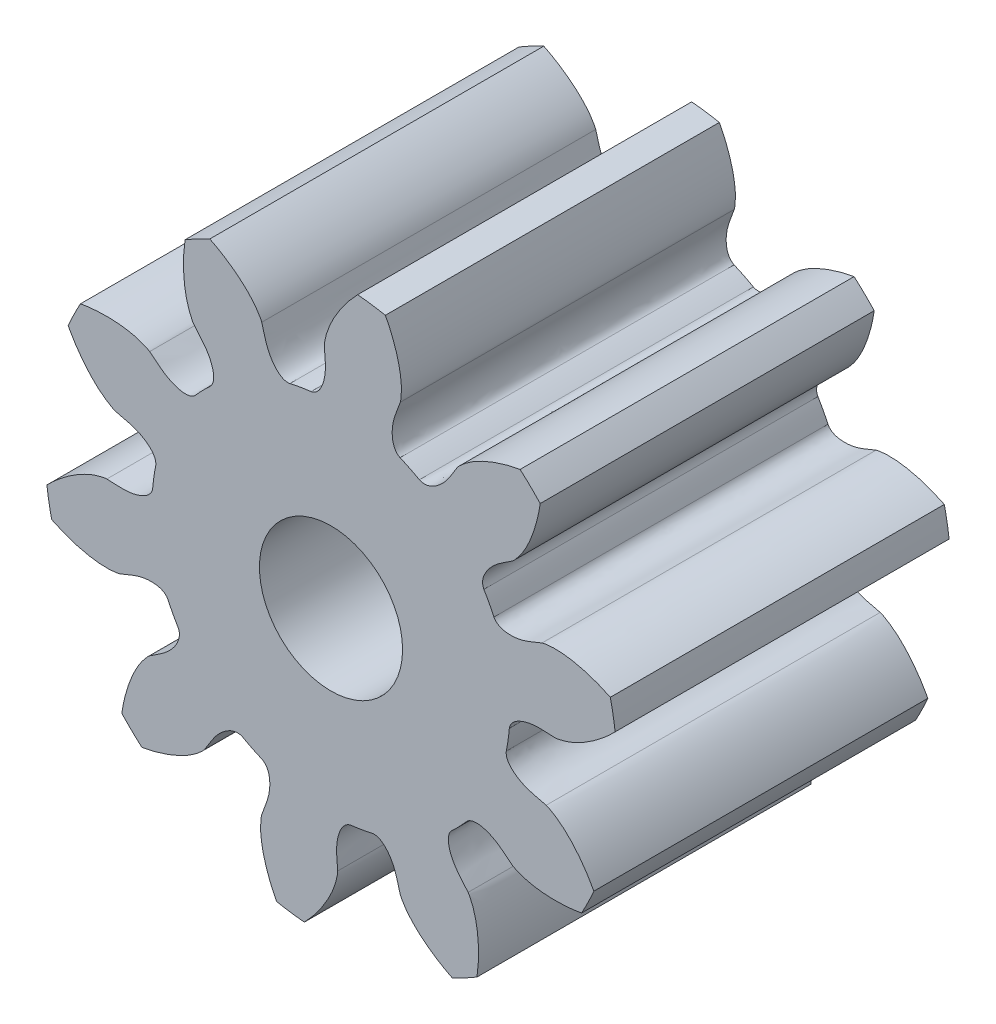
from build123d import *

# Parameters (mm, degrees)
ESQUISSE1_R        = 0.75
BOSS_EXTRU_1_DEPTH = 3.5


with BuildPart() as part:
    # Esquisse1 → Boss.-Extru.1 (new body)
    with BuildSketch(Plane.XY):
        with BuildLine():
            ThreePointArc((2.977310095, 0.368272455), (2.955741127, 0.513414445), (2.927100903, 0.657328154))
            add(Edge.make_bspline(
                [(2.211403727, 0.79214554), (2.222779445, 0.796220429), (2.274133198, 0.805614359), (2.359373738, 0.810478726), (2.538607422, 0.796225963), (2.732062921, 0.744216047), (2.878239296, 0.681280138), (2.927100903, 0.657328154)],
                knots=[0, 0, 0, 0, 0.036250587, 0.155621312, 0.255291203, 0.575254513, 0.744084786, 0.744084786, 0.744084786, 0.744084786], degree=3))
            add(Edge.make_bspline(
                [(2.211403727, 0.79214554), (2.132130324, 0.763749064), (1.99001212, 0.681956821), (1.750090704, 0.694113528), (1.707279056, 0.775127876)],
                knots=[0, 0, 0, 0, 0.252617676, 0.527509393, 0.527509393, 0.527509393, 0.527509393], degree=3))
            ThreePointArc((1.707279056, 0.775127876), (1.657764419, 0.876037746), (1.602292085, 0.973799299))
            add(Edge.make_bspline(
                [(1.90038092, 1.380707558), (1.832256922, 1.331212576), (1.684611138, 1.259880414), (1.559480437, 1.054813647), (1.602292085, 0.973799299)],
                knots=[0, 0, 0, 0, 0.252617676, 0.527509393, 0.527509393, 0.527509393, 0.527509393], degree=3))
            add(Edge.make_bspline(
                [(1.90038092, 1.380707558), (1.9101567, 1.387810078), (1.946851003, 1.424944725), (1.998895263, 1.49262786), (2.088102134, 1.648736761), (2.154127637, 1.837868182), (2.184488772, 1.994094501), (2.192229346, 2.04795764)],
                knots=[0, 0, 0, 0, 0.036250587, 0.155621312, 0.255291203, 0.575254513, 0.744084786, 0.744084786, 0.744084786, 0.744084786], degree=3))
            ThreePointArc((2.192229346, 2.04795764), (2.089467363, 2.152702055), (1.98170658, 2.25229639))
            add(Edge.make_bspline(
                [(1.32345173, 1.940689701), (1.33025972, 1.950672835), (1.366284165, 1.988457663), (1.432386008, 2.04249615), (1.585766668, 2.136316339), (1.772846116, 2.207949723), (1.928098087, 2.242953821), (1.98170658, 2.25229639)],
                knots=[0, 0, 0, 0, 0.036250587, 0.155621312, 0.255291203, 0.575254513, 0.744084786, 0.744084786, 0.744084786, 0.744084786], degree=3))
            add(Edge.make_bspline(
                [(1.32345173, 1.940689701), (1.27600923, 1.871120733), (1.209109462, 1.721414433), (1.007863426, 1.590227146), (0.925609036, 1.630605075)],
                knots=[0, 0, 0, 0, 0.252617676, 0.527509393, 0.527509393, 0.527509393, 0.527509393], degree=3))
            ThreePointArc((0.925609036, 1.630605075), (0.82623752, 1.683138901), (0.72389666, 1.729623839))
            add(Edge.make_bspline(
                [(0.72588092, 2.234031757), (0.699859868, 2.153947194), (0.622339913, 2.009454248), (0.641642271, 1.770001768), (0.72389666, 1.729623839)],
                knots=[0, 0, 0, 0, 0.252617676, 0.527509393, 0.527509393, 0.527509393, 0.527509393], degree=3))
            add(Edge.make_bspline(
                [(0.72588092, 2.234031757), (0.729614936, 2.245523876), (0.737474053, 2.297134806), (0.739795594, 2.382482461), (0.720206959, 2.561211698), (0.662454053, 2.753031049), (0.595189201, 2.897266624), (0.569791499, 2.945392614)],
                knots=[0, 0, 0, 0, 0.036250587, 0.155621312, 0.255291203, 0.575254513, 0.744084786, 0.744084786, 0.744084786, 0.744084786], degree=3))
            ThreePointArc((0.569791499, 2.945392614), (0.425088085, 2.969730648), (0.279367699, 2.986963958))
            add(Edge.make_bspline(
                [(-0.070013845, 2.347956359), (-0.070374004, 2.360034519), (-0.063438981, 2.411777724), (-0.041724492, 2.494349468), (0.027216945, 2.660406485), (0.136462351, 2.82832165), (0.241488941, 2.947895379), (0.279367699, 2.986963958)],
                knots=[0, 0, 0, 0, 0.036250587, 0.155621312, 0.255291203, 0.575254513, 0.744084786, 0.744084786, 0.744084786, 0.744084786], degree=3))
            add(Edge.make_bspline(
                [(-0.070013845, 2.347956359), (-0.06750402, 2.263787878), (-0.033631914, 2.103350241), (-0.119333425, 1.878928045), (-0.209612175, 1.863246558)],
                knots=[0, 0, 0, 0, 0.252617676, 0.527509393, 0.527509393, 0.527509393, 0.527509393], degree=3))
            ThreePointArc((-0.209612175, 1.863246558), (-0.320884028, 1.847338204), (-0.431002684, 1.824790861))
            add(Edge.make_bspline(
                [(-0.72588092, 2.234031757), (-0.699859868, 2.153947194), (-0.677644007, 1.991484859), (-0.521281435, 1.809109374), (-0.431002684, 1.824790861)],
                knots=[0, 0, 0, 0, 0.252617676, 0.527509393, 0.527509393, 0.527509393, 0.527509393], degree=3))
            add(Edge.make_bspline(
                [(-0.72588092, 2.234031757), (-0.729614936, 2.245523876), (-0.75359292, 2.291897469), (-0.801880846, 2.36230974), (-0.922782795, 2.495390819), (-1.082254463, 2.616629628), (-1.221452415, 2.693781371), (-1.270287335, 2.717787719)],
                knots=[0, 0, 0, 0, 0.036250587, 0.155621312, 0.255291203, 0.575254513, 0.744084786, 0.744084786, 0.744084786, 0.744084786], degree=3))
            ThreePointArc((-1.270287335, 2.717787719), (-1.401660393, 2.65242307), (-1.529680147, 2.580712818))
            add(Edge.make_bspline(
                [(-1.436736511, 1.858383491), (-1.44412725, 1.867943232), (-1.468930592, 1.913880668), (-1.499897654, 1.993446068), (-1.541728726, 2.168311777), (-1.552045394, 2.368370838), (-1.537360771, 2.526841097), (-1.529680147, 2.580712818)],
                knots=[0, 0, 0, 0, 0.036250587, 0.155621312, 0.255291203, 0.575254513, 0.744084786, 0.744084786, 0.744084786, 0.744084786], degree=3))
            add(Edge.make_bspline(
                [(-1.436736511, 1.858383491), (-1.385233029, 1.791764998), (-1.263527042, 1.681877747), (-1.200948963, 1.449942292), (-1.26476866, 1.384191185)],
                knots=[0, 0, 0, 0, 0.252617676, 0.527509393, 0.527509393, 0.527509393, 0.527509393], degree=3))
            ThreePointArc((-1.26476866, 1.384191185), (-1.345438785, 1.305917102), (-1.421273653, 1.222949796))
            add(Edge.make_bspline(
                [(-1.90038092, 1.380707558), (-1.832256922, 1.331212576), (-1.718790948, 1.212835941), (-1.48509335, 1.157198689), (-1.421273653, 1.222949796)],
                knots=[0, 0, 0, 0, 0.252617676, 0.527509393, 0.527509393, 0.527509393, 0.527509393], degree=3))
            add(Edge.make_bspline(
                [(-1.90038092, 1.380707558), (-1.9101567, 1.387810078), (-1.956813011, 1.411233197), (-2.037266059, 1.43981499), (-2.213300886, 1.476415463), (-2.413578559, 1.480764624), (-2.571540724, 1.461363192), (-2.625159582, 1.45208029)],
                knots=[0, 0, 0, 0, 0.036250587, 0.155621312, 0.255291203, 0.575254513, 0.744084786, 0.744084786, 0.744084786, 0.744084786], degree=3))
            ThreePointArc((-2.625159582, 1.45208029), (-2.693022242, 1.321980032), (-2.75444217, 1.188717096))
            add(Edge.make_bspline(
                [(-2.254674663, 0.658971294), (-2.266272971, 0.662361119), (-2.313340644, 0.684946248), (-2.385160892, 0.731114025), (-2.521786425, 0.847995669), (-2.64772455, 1.003782864), (-2.728990923, 1.140619401), (-2.75444217, 1.188717096)],
                knots=[0, 0, 0, 0, 0.036250587, 0.155621312, 0.255291203, 0.575254513, 0.744084786, 0.744084786, 0.744084786, 0.744084786], degree=3))
            add(Edge.make_bspline(
                [(-2.254674663, 0.658971294), (-2.173850103, 0.635348788), (-2.010797786, 0.617985118), (-1.823842817, 0.467127866), (-1.836826505, 0.376421826)],
                knots=[0, 0, 0, 0, 0.252617676, 0.527509393, 0.527509393, 0.527509393, 0.527509393], degree=3))
            ThreePointArc((-1.836826505, 0.376421826), (-1.856081655, 0.265680053), (-1.868666393, 0.153983476))
            add(Edge.make_bspline(
                [(-2.349, 0), (-2.264794108, 0), (-2.103418166, -0.029075083), (-1.881650081, 0.063277436), (-1.868666393, 0.153983476)],
                knots=[0, 0, 0, 0, 0.252617676, 0.527509393, 0.527509393, 0.527509393, 0.527509393], degree=3))
            add(Edge.make_bspline(
                [(-2.349, 0), (-2.361083529, 0), (-2.412597041, -0.00847419), (-2.494484881, -0.032640149), (-2.658413265, -0.106500419), (-2.822997679, -0.220702136), (-2.93938788, -0.329246056), (-2.977310095, -0.368272455)],
                knots=[0, 0, 0, 0, 0.036250587, 0.155621312, 0.255291203, 0.575254513, 0.744084786, 0.744084786, 0.744084786, 0.744084786], degree=3))
            ThreePointArc((-2.977310095, -0.368272455), (-2.955741127, -0.513414445), (-2.927100903, -0.657328154))
            add(Edge.make_bspline(
                [(-2.211403727, -0.79214554), (-2.222779445, -0.796220429), (-2.274133198, -0.805614359), (-2.359373738, -0.810478726), (-2.538607422, -0.796225963), (-2.732062921, -0.744216047), (-2.878239296, -0.681280138), (-2.927100903, -0.657328154)],
                knots=[0, 0, 0, 0, 0.036250587, 0.155621312, 0.255291203, 0.575254513, 0.744084786, 0.744084786, 0.744084786, 0.744084786], degree=3))
            add(Edge.make_bspline(
                [(-2.211403727, -0.79214554), (-2.132130324, -0.763749064), (-1.99001212, -0.681956821), (-1.750090704, -0.694113528), (-1.707279056, -0.775127876)],
                knots=[0, 0, 0, 0, 0.252617676, 0.527509393, 0.527509393, 0.527509393, 0.527509393], degree=3))
            ThreePointArc((-1.707279056, -0.775127876), (-1.657764419, -0.876037746), (-1.602292085, -0.973799299))
            add(Edge.make_bspline(
                [(-1.90038092, -1.380707558), (-1.832256922, -1.331212576), (-1.684611138, -1.259880414), (-1.559480437, -1.054813647), (-1.602292085, -0.973799299)],
                knots=[0, 0, 0, 0, 0.252617676, 0.527509393, 0.527509393, 0.527509393, 0.527509393], degree=3))
            add(Edge.make_bspline(
                [(-1.90038092, -1.380707558), (-1.9101567, -1.387810078), (-1.946851003, -1.424944725), (-1.998895263, -1.49262786), (-2.088102134, -1.648736761), (-2.154127637, -1.837868182), (-2.184488772, -1.994094501), (-2.192229346, -2.04795764)],
                knots=[0, 0, 0, 0, 0.036250587, 0.155621312, 0.255291203, 0.575254513, 0.744084786, 0.744084786, 0.744084786, 0.744084786], degree=3))
            ThreePointArc((-2.192229346, -2.04795764), (-2.089467363, -2.152702055), (-1.98170658, -2.25229639))
            add(Edge.make_bspline(
                [(-1.32345173, -1.940689701), (-1.33025972, -1.950672835), (-1.366284165, -1.988457663), (-1.432386008, -2.04249615), (-1.585766668, -2.136316339), (-1.772846116, -2.207949723), (-1.928098087, -2.242953821), (-1.98170658, -2.25229639)],
                knots=[0, 0, 0, 0, 0.036250587, 0.155621312, 0.255291203, 0.575254513, 0.744084786, 0.744084786, 0.744084786, 0.744084786], degree=3))
            add(Edge.make_bspline(
                [(-1.32345173, -1.940689701), (-1.27600923, -1.871120733), (-1.209109462, -1.721414433), (-1.007863426, -1.590227146), (-0.925609036, -1.630605075)],
                knots=[0, 0, 0, 0, 0.252617676, 0.527509393, 0.527509393, 0.527509393, 0.527509393], degree=3))
            ThreePointArc((-0.925609036, -1.630605075), (-0.82623752, -1.683138901), (-0.72389666, -1.729623839))
            add(Edge.make_bspline(
                [(-0.72588092, -2.234031757), (-0.699859868, -2.153947194), (-0.622339913, -2.009454248), (-0.641642271, -1.770001768), (-0.72389666, -1.729623839)],
                knots=[0, 0, 0, 0, 0.252617676, 0.527509393, 0.527509393, 0.527509393, 0.527509393], degree=3))
            add(Edge.make_bspline(
                [(-0.72588092, -2.234031757), (-0.729614936, -2.245523876), (-0.737474053, -2.297134806), (-0.739795594, -2.382482461), (-0.720206959, -2.561211698), (-0.662454053, -2.753031049), (-0.595189201, -2.897266624), (-0.569791499, -2.945392614)],
                knots=[0, 0, 0, 0, 0.036250587, 0.155621312, 0.255291203, 0.575254513, 0.744084786, 0.744084786, 0.744084786, 0.744084786], degree=3))
            ThreePointArc((-0.569791499, -2.945392614), (-0.425088085, -2.969730648), (-0.279367699, -2.986963958))
            add(Edge.make_bspline(
                [(0.070013845, -2.347956359), (0.070374004, -2.360034519), (0.063438981, -2.411777724), (0.041724492, -2.494349468), (-0.027216945, -2.660406485), (-0.136462351, -2.82832165), (-0.241488941, -2.947895379), (-0.279367699, -2.986963958)],
                knots=[0, 0, 0, 0, 0.036250587, 0.155621312, 0.255291203, 0.575254513, 0.744084786, 0.744084786, 0.744084786, 0.744084786], degree=3))
            add(Edge.make_bspline(
                [(0.070013845, -2.347956359), (0.06750402, -2.263787879), (0.033631914, -2.103350241), (0.119333425, -1.878928045), (0.209612175, -1.863246558)],
                knots=[0, 0, 0, 0, 0.252617676, 0.527509393, 0.527509393, 0.527509393, 0.527509393], degree=3))
            ThreePointArc((0.209612175, -1.863246558), (0.320884028, -1.847338204), (0.431002684, -1.824790861))
            add(Edge.make_bspline(
                [(0.72588092, -2.234031757), (0.699859868, -2.153947194), (0.677644007, -1.991484859), (0.521281435, -1.809109374), (0.431002684, -1.824790861)],
                knots=[0, 0, 0, 0, 0.252617676, 0.527509393, 0.527509393, 0.527509393, 0.527509393], degree=3))
            add(Edge.make_bspline(
                [(0.72588092, -2.234031757), (0.729614936, -2.245523876), (0.75359292, -2.291897469), (0.801880846, -2.36230974), (0.922782795, -2.495390819), (1.082254463, -2.616629628), (1.221452415, -2.693781371), (1.270287335, -2.717787719)],
                knots=[0, 0, 0, 0, 0.036250587, 0.155621312, 0.255291203, 0.575254513, 0.744084786, 0.744084786, 0.744084786, 0.744084786], degree=3))
            ThreePointArc((1.270287335, -2.717787719), (1.401660393, -2.65242307), (1.529680147, -2.580712818))
            add(Edge.make_bspline(
                [(1.436736511, -1.858383491), (1.44412725, -1.867943232), (1.468930592, -1.913880668), (1.499897654, -1.993446068), (1.541728726, -2.168311777), (1.552045394, -2.368370838), (1.537360771, -2.526841097), (1.529680147, -2.580712818)],
                knots=[0, 0, 0, 0, 0.036250587, 0.155621312, 0.255291203, 0.575254513, 0.744084786, 0.744084786, 0.744084786, 0.744084786], degree=3))
            add(Edge.make_bspline(
                [(1.436736511, -1.858383491), (1.385233029, -1.791764998), (1.263527042, -1.681877747), (1.200948963, -1.449942292), (1.26476866, -1.384191185)],
                knots=[0, 0, 0, 0, 0.252617676, 0.527509393, 0.527509393, 0.527509393, 0.527509393], degree=3))
            ThreePointArc((1.26476866, -1.384191185), (1.345438785, -1.305917102), (1.421273653, -1.222949796))
            add(Edge.make_bspline(
                [(1.90038092, -1.380707558), (1.832256922, -1.331212576), (1.718790948, -1.212835941), (1.48509335, -1.157198689), (1.421273653, -1.222949796)],
                knots=[0, 0, 0, 0, 0.252617676, 0.527509393, 0.527509393, 0.527509393, 0.527509393], degree=3))
            add(Edge.make_bspline(
                [(1.90038092, -1.380707558), (1.9101567, -1.387810078), (1.956813011, -1.411233197), (2.037266059, -1.43981499), (2.213300886, -1.476415463), (2.413578559, -1.480764624), (2.571540724, -1.461363192), (2.625159582, -1.45208029)],
                knots=[0, 0, 0, 0, 0.036250587, 0.155621312, 0.255291203, 0.575254513, 0.744084786, 0.744084786, 0.744084786, 0.744084786], degree=3))
            ThreePointArc((2.625159582, -1.45208029), (2.693022242, -1.321980032), (2.75444217, -1.188717096))
            add(Edge.make_bspline(
                [(2.254674663, -0.658971294), (2.266272971, -0.662361119), (2.313340644, -0.684946248), (2.385160892, -0.731114025), (2.521786425, -0.847995669), (2.64772455, -1.003782864), (2.728990923, -1.140619401), (2.75444217, -1.188717096)],
                knots=[0, 0, 0, 0, 0.036250587, 0.155621312, 0.255291203, 0.575254513, 0.744084786, 0.744084786, 0.744084786, 0.744084786], degree=3))
            add(Edge.make_bspline(
                [(2.254674663, -0.658971294), (2.173850103, -0.635348788), (2.010797786, -0.617985118), (1.823842817, -0.467127866), (1.836826505, -0.376421826)],
                knots=[0, 0, 0, 0, 0.252617676, 0.527509393, 0.527509393, 0.527509393, 0.527509393], degree=3))
            ThreePointArc((1.836826505, -0.376421826), (1.856081655, -0.265680053), (1.868666393, -0.153983476))
            add(Edge.make_bspline(
                [(2.349, 0), (2.264794108, 0), (2.103418166, 0.029075083), (1.881650081, -0.063277436), (1.868666393, -0.153983476)],
                knots=[0, 0, 0, 0, 0.252617676, 0.527509393, 0.527509393, 0.527509393, 0.527509393], degree=3))
            add(Edge.make_bspline(
                [(2.349, 0), (2.361083529, 0), (2.412597041, 0.00847419), (2.494484881, 0.032640149), (2.658413265, 0.106500419), (2.822997679, 0.220702136), (2.93938788, 0.329246056), (2.977310095, 0.368272455)],
                knots=[0, 0, 0, 0, 0.036250587, 0.155621312, 0.255291203, 0.575254513, 0.744084786, 0.744084786, 0.744084786, 0.744084786], degree=3))
        make_face()
        Circle(ESQUISSE1_R, mode=Mode.SUBTRACT)
    extrude(amount=BOSS_EXTRU_1_DEPTH)


solid = part.part
